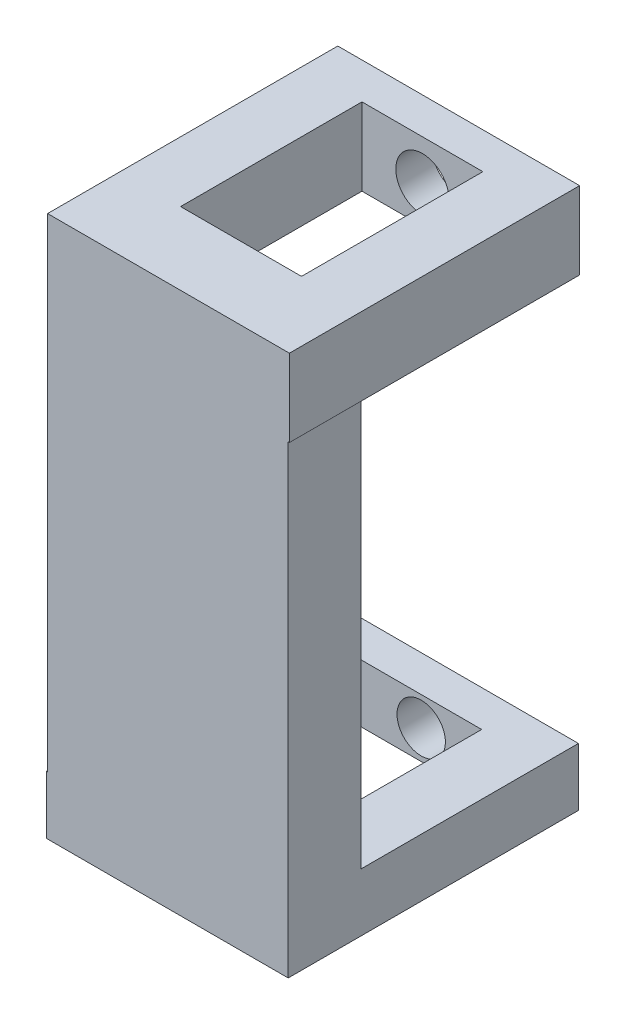
from build123d import *

# Parameters (mm, degrees)
SZKIC2_W                      = 10
SZKIC2_H                      = 3.2
SZKIC2_R                      = 1.10000034
DODANIE_WYCI_GNI_CIE1_DEPTH   = 12
SZKIC2_H_2                    = 2.4000007
SZKIC2_R_2                    = 1.00000054
DODANIE_WYCI_GNI_CIE1_2_DEPTH = 12
SZKIC3_W                      = 5
SZKIC3_H                      = 3.2
SZKIC3_H_2                    = 2.4000007
WYTNIJ_WYCI_GNI_CIE1_DEPTH    = 10.5
SZKIC4_W                      = 9.95021092
SZKIC4_H                      = 22.39976104
DODANIE_WYCI_GNI_CIE2_DEPTH   = 3


with BuildPart() as part:
    # Szkic2 → Dodanie-wyciągnięcie1 (new body)
    with BuildSketch(Plane.XY.offset(158.832884642)):
        with Locations((-14.923531216, -1.67449554)):
            Rectangle(SZKIC2_W, SZKIC2_H)
        with Locations((-14.923531216, -1.77449554)):
            Circle(SZKIC2_R, mode=Mode.SUBTRACT)
    extrude(amount=DODANIE_WYCI_GNI_CIE1_DEPTH)


with BuildPart() as body_2:
    # Szkic2 → Dodanie-wyci_gni_cie1 2 (new body)
    with BuildSketch(Plane.XY.offset(158.832884642)):
        with Locations((-14.973320296, -21.27425623)):
            Rectangle(SZKIC2_W, SZKIC2_H_2)
        with Locations((-14.973320296, -21.27425588)):
            Circle(SZKIC2_R_2, mode=Mode.SUBTRACT)
    extrude(amount=DODANIE_WYCI_GNI_CIE1_2_DEPTH)


with BuildPart() as wytnij_wyci_gni_cie1_tool:
    # Szkic3 → Wytnij-wyciągnięcie1 (new body)
    with BuildSketch(Plane.XY.offset(170.832884642)):
        with Locations((-14.923531216, -1.67449554)):
            Rectangle(SZKIC3_W, SZKIC3_H)
        with Locations((-14.973320296, -21.27425623)):
            Rectangle(SZKIC3_W, SZKIC3_H_2)
    extrude(amount=-WYTNIJ_WYCI_GNI_CIE1_DEPTH)


with BuildPart() as part_1:
    add(part.part)

    # Wytnij-wyciągnięcie1: cut by wytnij_wyci_gni_cie1_tool
    add(wytnij_wyci_gni_cie1_tool.part, mode=Mode.SUBTRACT)



with BuildPart() as body_2_1:
    add(body_2.part)

    # Wytnij-wyciągnięcie1: cut by wytnij_wyci_gni_cie1_tool
    add(wytnij_wyci_gni_cie1_tool.part, mode=Mode.SUBTRACT)


with BuildPart() as part_2:
    add(part_1.part)

    add(body_2_1.part)  # Dodanie-wyciągnięcie2 merges body 2
    # Szkic4 → Dodanie-wyciągnięcie2 (add)
    with BuildSketch(Plane.XY.offset(170.832884642)):
        with Locations((-14.948425756, -11.27437606)):
            Rectangle(SZKIC4_W, SZKIC4_H)
    extrude(amount=-DODANIE_WYCI_GNI_CIE2_DEPTH)


solid = part_2.part
